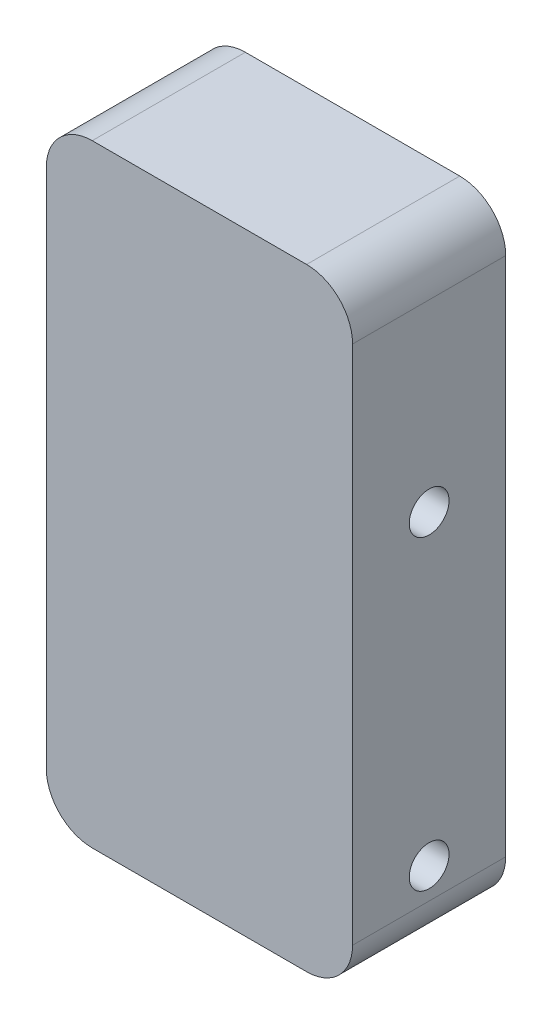
from build123d import *

# Parameters (mm, degrees)
SKETCH_1_W          = 20
SKETCH_1_H          = 40
EXTRUDE_1_DEPTH     = 10
FILLET_1_R          = 3
SKETCH_2_R          = 1.3
CUT_EXTRUDE_1_DEPTH = 15


with BuildPart() as part:
    # ｽｹｯﾁ1 → ﾎﾞｽ - 押し出し1 (new body)
    with BuildSketch(Plane.XY):
        Rectangle(SKETCH_1_W, SKETCH_1_H)
    extrude(amount=EXTRUDE_1_DEPTH)

    # ﾌｨﾚｯﾄ1
    fillet_1_edges = [part.edges().sort_by_distance(p)[0] for p in [
        (-10, 20, 5),
        (10, 20, 5),
        (10, -20, 5),
        (-10, -20, 5),
    ]]
    fillet(fillet_1_edges, radius=FILLET_1_R)

    # ｽｹｯﾁ2 → ｶｯﾄ - 押し出し1 (cut)
    with BuildSketch(Plane(origin=(10, 0, 0), x_dir=(0, 0, -1), z_dir=(1, 0, 0))):
        with Locations((-5, -15)):
            Circle(SKETCH_2_R)
        with Locations((-5, 5)):
            Circle(SKETCH_2_R)
    extrude(amount=-CUT_EXTRUDE_1_DEPTH, mode=Mode.SUBTRACT)


solid = part.part
